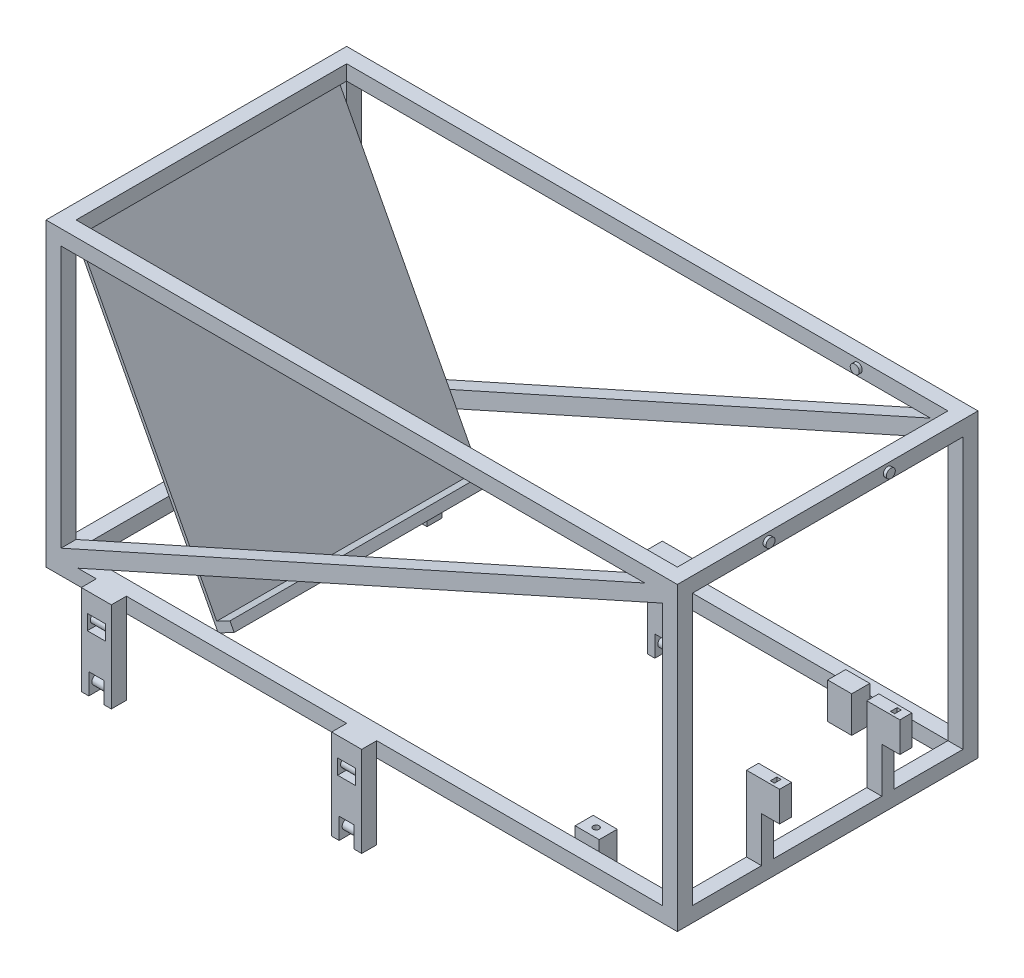
from build123d import *

# Parameters (mm, degrees)
SKETCH1_W                 = 2100
SKETCH1_H                 = 1000
BOSS_EXTRUDE1_DEPTH       = 1000
CUT_EXTRUDE1_DEPTH        = 1534.786165018
CUT_EXTRUDE1_DEPTH_BACK   = 1534.786165018
SKETCH2_W                 = 2000
SKETCH2_H                 = 900
CUT_EXTRUDE2_DEPTH        = 1762.391495381
CUT_EXTRUDE2_DEPTH_BACK   = 1762.391495381
SKETCH3_W                 = 2000
SKETCH3_H                 = 900
CUT_EXTRUDE3_DEPTH        = 2380.075450674
CUT_EXTRUDE3_DEPTH_BACK   = 2380.075450674
SKETCH4_W                 = 900
SKETCH4_H                 = 900
SKETCH11_R                = 15
BOSS_EXTRUDE4_DEPTH       = 10
SKETCH13_W                = 80
SKETCH13_H                = 120
BOSS_EXTRUDE6_DEPTH       = 60
CUT_EXTRUDE5_DEPTH        = 1480.771941888
CUT_EXTRUDE5_DEPTH_BACK   = 1480.771941888
SKETCH14_R                = 10
BOSS_EXTRUDE9_DEPTH       = 50
SKETCH18_W                = 25
SKETCH18_H                = 70
SKETCH18_W_2              = 100
SKETCH18_H_2              = 50
BOSS_EXTRUDE10_DEPTH      = 50
BOSS_EXTRUDE11_REACH      = 2182.2
SKETCH19_R                = 15
LPATTERN1_COUNT           = 2
LPATTERN1_PITCH           = 832.6
MIRROR6_COPY_1_SKETCH_W   = 25
MIRROR6_COPY_1_SKETCH_H   = 70
MIRROR6_COPY_1_SKETCH_W_2 = 100
MIRROR6_COPY_1_SKETCH_H_2 = 50
MIRROR6_COPY_1_DEPTH      = 50
MIRROR6_COPY_2_REACH      = 2182.2
MIRROR6_COPY_2_SKETCH_R   = 15
MIRROR6_COPY_3_SKETCH_W   = 25
MIRROR6_COPY_3_SKETCH_H   = 70
MIRROR6_COPY_3_SKETCH_W_2 = 100
MIRROR6_COPY_3_SKETCH_H_2 = 50
MIRROR6_COPY_3_DEPTH      = 50
MIRROR6_COPY_4_REACH      = 2182.2
MIRROR6_COPY_4_SKETCH_R   = 15
SKETCH21_W                = 871.350730207
SKETCH21_H                = 1070.163382418
BOSS_EXTRUDE12_DEPTH      = 10
SKETCH22_W                = 871.350730207
SKETCH22_H                = 30
BOSS_EXTRUDE13_DEPTH      = 50
CUT_EXTRUDE6_DEPTH        = 1520.045753096
CUT_EXTRUDE6_DEPTH_BACK   = 1520.045753096
SKETCH23_W                = 100
SKETCH23_H                = 50
SKETCH24_R                = 15
BOSS_EXTRUDE14_DEPTH      = 10
LPATTERN2_COUNT           = 2
LPATTERN2_PITCH           = 400
SKETCH25_W                = 40
SKETCH25_H                = 300
BOSS_EXTRUDE15_DEPTH      = 50
SKETCH26_W                = 40
SKETCH26_H                = 100
BOSS_EXTRUDE16_DEPTH      = 60
SKETCH27_W                = 14
SKETCH27_H                = 22
CUT_EXTRUDE7_DEPTH        = 1423.884394461
LPATTERN3_COUNT           = 2
LPATTERN3_PITCH           = 400
CUT_EXTRUDE8_START        = -20
SKETCH29_W                = 50
SKETCH29_H                = 50
CUT_EXTRUDE8_DEPTH        = 60
BOSS_EXTRUDE17_REACH      = 2229.249
SKETCH30_R                = 15
CUT_EXTRUDE9_START        = -20
SKETCH31_W                = 50
SKETCH31_H                = 50
CUT_EXTRUDE9_DEPTH        = 60
BOSS_EXTRUDE18_REACH      = 1615.084
SKETCH32_R                = 15


with BuildPart() as part:
    # Sketch1 → Boss-Extrude1 (new body)
    with BuildSketch(Plane(origin=(0, 0, 0), x_dir=(1, 0, 0), z_dir=(0, 1, 0))):
        Rectangle(SKETCH1_W, SKETCH1_H)
    extrude(amount=BOSS_EXTRUDE1_DEPTH)

    # Sketch2 → Cut-Extrude1 (cut, two sides: drawn at the far end of the back side and taken through both)
    with BuildSketch(Plane(origin=(0, 1000, 0), x_dir=(1, 0, 0), z_dir=(0, 1, 0)).offset(-CUT_EXTRUDE1_DEPTH_BACK)):
        Rectangle(SKETCH2_W, SKETCH2_H)
    extrude(amount=CUT_EXTRUDE1_DEPTH + CUT_EXTRUDE1_DEPTH_BACK, mode=Mode.SUBTRACT)

    # Sketch3 → Cut-Extrude2 (cut, two sides: drawn at the far end of the back side and taken through both)
    with BuildSketch(Plane.XY.offset(500).offset(-CUT_EXTRUDE2_DEPTH_BACK)):
        with Locations((0, 500)):
            Rectangle(SKETCH3_W, SKETCH3_H)
    extrude(amount=CUT_EXTRUDE2_DEPTH + CUT_EXTRUDE2_DEPTH_BACK, mode=Mode.SUBTRACT)

    # Sketch4 → Cut-Extrude3 (cut, two sides: drawn at the far end of the back side and taken through both)
    with BuildSketch(Plane.ZY.offset(1050).offset(-CUT_EXTRUDE3_DEPTH_BACK)):
        with Locations((0, 500)):
            Rectangle(SKETCH4_W, SKETCH4_H)
    extrude(amount=CUT_EXTRUDE3_DEPTH + CUT_EXTRUDE3_DEPTH_BACK, mode=Mode.SUBTRACT)

    # Sketch11 → Boss-Extrude4 (add)
    with BuildSketch(Plane(origin=(0, 0, 450), x_dir=(-1, 0, 0), z_dir=(0, 0, -1))):
        with Locations(Location((-700, 975, 0), (0, 0, 180))):
            Circle(SKETCH11_R)
    boss_extrude4 = extrude(amount=BOSS_EXTRUDE4_DEPTH)

    # Sketch13 → Boss-Extrude6 (add)
    with BuildSketch(Plane(origin=(0, 0, 450), x_dir=(-1, 0, 0), z_dir=(0, 0, -1))):
        with Locations((-700, 25)):
            Rectangle(SKETCH13_W, SKETCH13_H)
    boss_extrude6 = extrude(amount=BOSS_EXTRUDE6_DEPTH)

    # Sketch14 → Cut-Extrude5 (cut, two sides: drawn at the far end of the back side and taken through both)
    with BuildSketch(Plane(origin=(0, 85, 0), x_dir=(1, 0, 0), z_dir=(0, 1, 0)).offset(-CUT_EXTRUDE5_DEPTH_BACK)):
        with Locations(Location((700, -420, 0), (0, 0, 270))):
            Circle(SKETCH14_R)
    extrude(amount=CUT_EXTRUDE5_DEPTH + CUT_EXTRUDE5_DEPTH_BACK, mode=Mode.SUBTRACT)

    # Mirror3: Boss-Extrude4 across plane
    add(boss_extrude4.mirror(Plane.XY))

    # Sketch17 → Boss-Extrude9 (add)
    with BuildSketch(Plane(origin=(0, 0, -500), x_dir=(-1, 0, 0), z_dir=(0, 0, -1))):
        Polygon((-1000, 921.329829059), (943.812412752, 50), (1000, 50), (1000, 79.607053118), (-941.722362412, 950), (-1000, 950), align=None)
    boss_extrude9 = extrude(amount=-BOSS_EXTRUDE9_DEPTH)

    # Mirror4: Boss-Extrude9 across plane
    add(boss_extrude9.mirror(Plane.XY))

    # Sketch18 → Boss-Extrude10 (add)
    with BuildSketch(Plane(origin=(0, 0, -500), x_dir=(-1, 0, 0), z_dir=(0, 0, -1))):
        with Locations((-870.12586946, -215)):
            Rectangle(SKETCH18_W, SKETCH18_H)
        with Locations((-795.12586946, -215)):
            Rectangle(SKETCH18_W, SKETCH18_H)
        Polygon((-882.62586946, 0), (-882.62586946, -180), (-857.62586946, -180), (-807.62586946, -180), (-782.62586946, -180), (-782.62586946, 0), align=None)
        with Locations((-832.62586946, 25)):
            Rectangle(SKETCH18_W_2, SKETCH18_H_2)
    boss_extrude10 = extrude(amount=BOSS_EXTRUDE10_DEPTH)

    # Sketch19 → Boss-Extrude11 (add, up to next)
    with BuildSketch(Plane(origin=(807.62586946, 0, 0), x_dir=(0, 0, -1), z_dir=(1, 0, 0)), mode=Mode.PRIVATE) as boss_extrude11_sk1:
        with Locations(Location((525, -215, 0), (0, 0, 180))):
            Circle(SKETCH19_R)
    boss_extrude11_tool1 = extrude(boss_extrude11_sk1.sketch, amount=BOSS_EXTRUDE11_REACH, mode=Mode.PRIVATE) - part.part
    boss_extrude11 = boss_extrude11_tool1.solids().sort_by_distance((807.625869, -215, -525))[0]
    add(boss_extrude11)

    # Mirror5: Boss-Extrude10, Boss-Extrude11 across plane
    add(boss_extrude10.mirror(Plane(origin=(0, 0, 0), x_dir=(0, 0, 1), z_dir=(1, 0, 0))))
    add(boss_extrude11.mirror(Plane(origin=(0, 0, 0), x_dir=(0, 0, 1), z_dir=(1, 0, 0))))

    # LPattern1: Boss-Extrude10, Boss-Extrude11 ×2
    with Locations(*[(-i * LPATTERN1_PITCH, 0, 0) for i in range(1, LPATTERN1_COUNT)]):
        add(boss_extrude10)
        add(boss_extrude11)

    # Mirror6: Boss-Extrude10, Boss-Extrude11 across plane
    add(boss_extrude10.mirror(Plane.XY))
    add(boss_extrude11.mirror(Plane.XY))

    # Mirror6 copy 1 sketch → Mirror6 copy 1 (add)
    with BuildSketch(Plane.XY.offset(500)):
        with Locations((-870.12586946, -215)):
            Rectangle(MIRROR6_COPY_1_SKETCH_W, MIRROR6_COPY_1_SKETCH_H)
        with Locations((-795.12586946, -215)):
            Rectangle(MIRROR6_COPY_1_SKETCH_W, MIRROR6_COPY_1_SKETCH_H)
        Polygon((-882.62586946, 0), (-882.62586946, -180), (-857.62586946, -180), (-807.62586946, -180), (-782.62586946, -180), (-782.62586946, 0), align=None)
        with Locations((-832.62586946, 25)):
            Rectangle(MIRROR6_COPY_1_SKETCH_W_2, MIRROR6_COPY_1_SKETCH_H_2)
    extrude(amount=MIRROR6_COPY_1_DEPTH)

    # Mirror6 copy 2 sketch → Mirror6 copy 2 (add, up to next)
    with BuildSketch(Plane.ZY.offset(807.62586946), mode=Mode.PRIVATE) as mirror6_copy_2_sk1:
        with Locations(Location((525, -215, 0), (0, 0, 180))):
            Circle(MIRROR6_COPY_2_SKETCH_R)
    mirror6_copy_2_tool1 = extrude(mirror6_copy_2_sk1.sketch, amount=MIRROR6_COPY_2_REACH, mode=Mode.PRIVATE) - part.part
    add(mirror6_copy_2_tool1.solids().sort_by_distance((-807.625869, -215, 525))[0])

    # Mirror6 copy 3 sketch → Mirror6 copy 3 (add)
    with BuildSketch(Plane(origin=(-832.6, 0, 500), x_dir=(-1, 0, 0), z_dir=(0, 0, 1))):
        with Locations((-870.12586946, 215)):
            Rectangle(MIRROR6_COPY_3_SKETCH_W, MIRROR6_COPY_3_SKETCH_H)
        with Locations((-795.12586946, 215)):
            Rectangle(MIRROR6_COPY_3_SKETCH_W, MIRROR6_COPY_3_SKETCH_H)
        Polygon((-882.62586946, 0), (-882.62586946, 180), (-857.62586946, 180), (-807.62586946, 180), (-782.62586946, 180), (-782.62586946, 0), align=None)
        with Locations((-832.62586946, -25)):
            Rectangle(MIRROR6_COPY_3_SKETCH_W_2, MIRROR6_COPY_3_SKETCH_H_2)
    extrude(amount=MIRROR6_COPY_3_DEPTH)

    # Mirror6 copy 4 sketch → Mirror6 copy 4 (add, up to next)
    with BuildSketch(Plane(origin=(-24.97413054, 0, 0), x_dir=(0, 0, 1), z_dir=(1, 0, 0)), mode=Mode.PRIVATE) as mirror6_copy_4_sk1:
        with Locations((525, 215)):
            Circle(MIRROR6_COPY_4_SKETCH_R)
    mirror6_copy_4_tool1 = extrude(mirror6_copy_4_sk1.sketch, amount=MIRROR6_COPY_4_REACH, mode=Mode.PRIVATE) - part.part
    add(mirror6_copy_4_tool1.solids().sort_by_distance((-24.974131, -215, 525))[0])

    # Mirror7: Boss-Extrude6 across plane
    add(boss_extrude6.mirror(Plane.XY))

    # Sketch21 → Boss-Extrude12 (add)
    with BuildSketch(Plane(origin=(-412.59648232, -216.23351584, 0), x_dir=(0, 0, -1), z_dir=(0.8857330874212328, 0.4641948920951746, 0))):
        with Locations((0.799880363, 814.846288307)):
            Rectangle(SKETCH21_W, SKETCH21_H)
    extrude(amount=BOSS_EXTRUDE12_DEPTH)

    # Sketch22 → Boss-Extrude13 (add)
    with BuildSketch(Plane(origin=(-403.739151446, -211.591566919, 0), x_dir=(0, 0, -1), z_dir=(0.8857330874212327, 0.4641948920951747, 0))):
        with Locations((0.799880363, 294.764597098)):
            Rectangle(SKETCH22_W, SKETCH22_H)
    extrude(amount=BOSS_EXTRUDE13_DEPTH)

    # Sketch23 → Cut-Extrude6 (cut, two sides: drawn at the far end of the back side and taken through both)
    with BuildSketch(Plane(origin=(0, 50, 0), x_dir=(1, 0, 0), z_dir=(0, 1, 0)).offset(-CUT_EXTRUDE6_DEPTH_BACK)):
        with Locations((832.62586946, 525)):
            Rectangle(SKETCH23_W, SKETCH23_H)
        with Locations((832.62586946, -525)):
            Rectangle(SKETCH23_W, SKETCH23_H)
    extrude(amount=CUT_EXTRUDE6_DEPTH + CUT_EXTRUDE6_DEPTH_BACK, mode=Mode.SUBTRACT)

    # Sketch24 → Boss-Extrude14 (add)
    with BuildSketch(Plane(origin=(1050, 0, 0), x_dir=(0, 0, -1), z_dir=(1, 0, 0))):
        with Locations(Location((-200, 975, 0), (0, 0, 180))):
            Circle(SKETCH24_R)
    boss_extrude14 = extrude(amount=BOSS_EXTRUDE14_DEPTH)

    # LPattern2: Boss-Extrude14 ×2
    with Locations(*[(0, 0, -i * LPATTERN2_PITCH) for i in range(1, LPATTERN2_COUNT)]):
        add(boss_extrude14)

    # Sketch25 → Boss-Extrude15 (add)
    with BuildSketch(Plane(origin=(1050, 0, 0), x_dir=(0, 0, -1), z_dir=(1, 0, 0))):
        with Locations((-200, 150)):
            Rectangle(SKETCH25_W, SKETCH25_H)
    boss_extrude15 = extrude(amount=-BOSS_EXTRUDE15_DEPTH)

    # Sketch26 → Boss-Extrude16 (add)
    with BuildSketch(Plane(origin=(1050, 0, 0), x_dir=(0, 0, -1), z_dir=(1, 0, 0))):
        with Locations((-200, 250)):
            Rectangle(SKETCH26_W, SKETCH26_H)
    boss_extrude16 = extrude(amount=BOSS_EXTRUDE16_DEPTH)

    # Sketch27 → Cut-Extrude7 (cut, symmetric)
    with BuildSketch(Plane(origin=(0, 300, 0), x_dir=(1, 0, 0), z_dir=(0, 1, 0))):
        with Locations((1077, -200)):
            Rectangle(SKETCH27_W, SKETCH27_H)
    cut_extrude7 = extrude(amount=CUT_EXTRUDE7_DEPTH, both=True, mode=Mode.SUBTRACT)

    # LPattern3: Boss-Extrude15, Boss-Extrude16, Cut-Extrude7 ×2
    with Locations(*[(0, 0, -i * LPATTERN3_PITCH) for i in range(1, LPATTERN3_COUNT)]):
        add(boss_extrude15)
        add(boss_extrude16)
        add(cut_extrude7, mode=Mode.SUBTRACT)

    # Sketch29 → Cut-Extrude8 (cut)
    with BuildSketch(Plane.ZY.offset(882.62586946).offset(CUT_EXTRUDE8_START)):
        with Locations((-525, -39.5)):
            Rectangle(SKETCH29_W, SKETCH29_H)
    cut_extrude8 = extrude(amount=-CUT_EXTRUDE8_DEPTH, mode=Mode.SUBTRACT)

    # Sketch30 → Boss-Extrude17 (add, up to next)
    with BuildSketch(Plane.ZY.offset(802.62586946), mode=Mode.PRIVATE) as boss_extrude17_sk1:
        with Locations((-525, -39.5)):
            Circle(SKETCH30_R)
    boss_extrude17_tool1 = extrude(boss_extrude17_sk1.sketch, amount=BOSS_EXTRUDE17_REACH, mode=Mode.PRIVATE) - part.part
    boss_extrude17 = boss_extrude17_tool1.solids().sort_by_distance((-802.625869, -39.5, -525))[0]
    add(boss_extrude17)

    # Sketch31 → Cut-Extrude9 (cut)
    with BuildSketch(Plane(origin=(50.02586946, 0, 0), x_dir=(0, 0, -1), z_dir=(1, 0, 0)).offset(CUT_EXTRUDE9_START)):
        with Locations((525, -39.5)):
            Rectangle(SKETCH31_W, SKETCH31_H)
    cut_extrude9 = extrude(amount=-CUT_EXTRUDE9_DEPTH, mode=Mode.SUBTRACT)

    # Sketch32 → Boss-Extrude18 (add, up to next)
    with BuildSketch(Plane(origin=(-29.97413054, 0, 0), x_dir=(0, 0, -1), z_dir=(1, 0, 0)), mode=Mode.PRIVATE) as boss_extrude18_sk1:
        with Locations(Location((525, -39.5, 0), (0, 0, 180))):
            Circle(SKETCH32_R)
    boss_extrude18_tool1 = extrude(boss_extrude18_sk1.sketch, amount=BOSS_EXTRUDE18_REACH, mode=Mode.PRIVATE) - part.part
    boss_extrude18 = boss_extrude18_tool1.solids().sort_by_distance((-29.974131, -39.5, -525))[0]
    add(boss_extrude18)

    # Mirror8: Cut-Extrude8, Boss-Extrude17, Cut-Extrude9, Boss-Extrude18 across plane
    add(cut_extrude8.mirror(Plane.XY), mode=Mode.SUBTRACT)
    add(boss_extrude17.mirror(Plane.XY))
    add(cut_extrude9.mirror(Plane.XY), mode=Mode.SUBTRACT)
    add(boss_extrude18.mirror(Plane.XY))


solid = part.part
